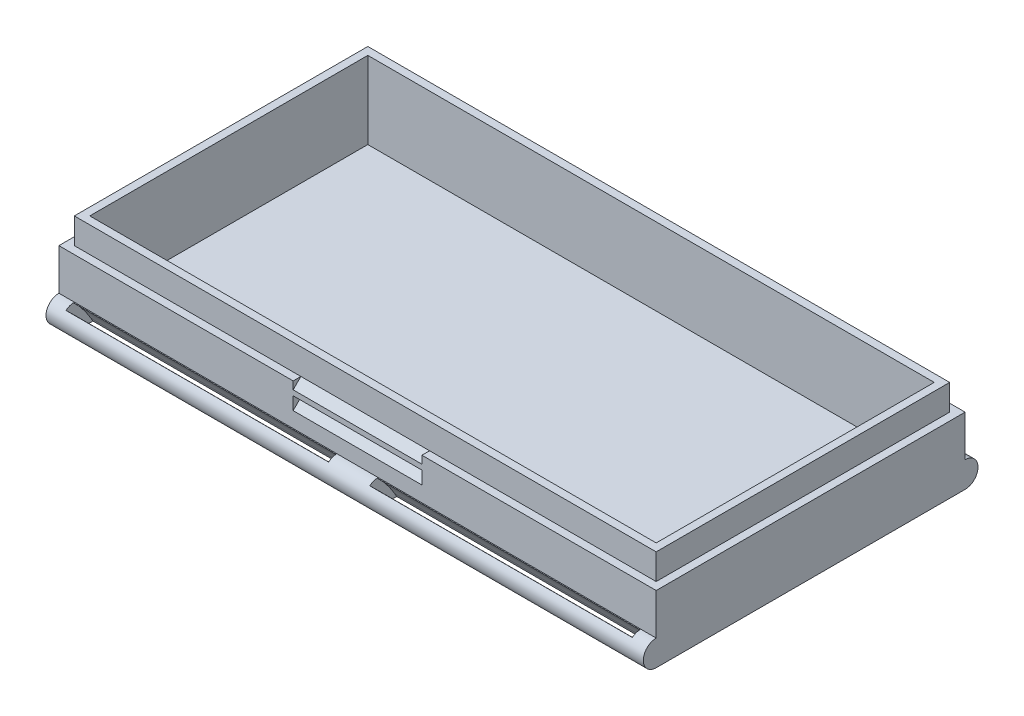
from build123d import *

# Parameters (mm, degrees)
SKETCH1_W                       = 116
SKETCH1_H                       = 60
SKETCH1_W_2                     = 110
SKETCH1_H_2                     = 54
BOSS_EXTRUDE1_DEPTH             = 10
SKETCH2_W                       = 116
SKETCH2_H                       = 60
BOSS_EXTRUDE2_DEPTH             = 3
CUT_EXTRUDE1_DEPTH              = 12.5
BOSS_EXTRUDE4_REACH             = 68.061
BOSS_EXTRUDE4_DIRECTION_2_REACH = 68.061
BOSS_EXTRUDE5_DEPTH             = 55
CUT_EXTRUDE2_DEPTH              = 4
SKETCH7_W                       = 113
SKETCH7_H                       = 57
SKETCH7_W_2                     = 110
SKETCH7_H_2                     = 54
BOSS_EXTRUDE6_DEPTH             = 5


with BuildPart() as part:
    # Sketch1 → Boss-Extrude1 (new body)
    with BuildSketch(Plane(origin=(0, 0, 0), x_dir=(1, 0, 0), z_dir=(0, 1, 0))):
        Rectangle(SKETCH1_W, SKETCH1_H)
        Rectangle(SKETCH1_W_2, SKETCH1_H_2, mode=Mode.SUBTRACT)
    extrude(amount=BOSS_EXTRUDE1_DEPTH)

    # Sketch2 → Boss-Extrude2 (add)
    with BuildSketch(Plane.XZ):
        Rectangle(SKETCH2_W, SKETCH2_H)
    extrude(amount=BOSS_EXTRUDE2_DEPTH)

    # Sketch3 → Cut-Extrude1 (cut, symmetric)
    with BuildSketch(Plane(origin=(0, 0, 0), x_dir=(0, 0, -1), z_dir=(1, 0, 0))):
        Polygon((-28.5, 10), (-31, 10), (-31, 4), (-28.5, 6.5), (-28.5, 7.5), (-30, 7.5), (-30, 8.5), align=None)
    cut_extrude1 = extrude(amount=CUT_EXTRUDE1_DEPTH, both=True, mode=Mode.SUBTRACT)

    # Mirror1: Cut-Extrude1 across plane
    add(cut_extrude1.mirror(Plane.XY), mode=Mode.SUBTRACT)

    # Boss-Extrude4: up to this face of the body (flat: up to its plane)
    boss_extrude4_end = Plane(part.part.faces().sort_by_distance((58, 3.5, 0))[0])
    # Sketch4 → Boss-Extrude4 (add, up to the picked face)
    with BuildSketch(Plane(origin=(0, 0, 0), x_dir=(0, 0, -1), z_dir=(1, 0, 0)), mode=Mode.PRIVATE) as boss_extrude4_sk1:
        with BuildLine():
            Line((30, 2), (30, -3))
            ThreePointArc((30, -3), (32.5, -0.5), (30, 2))
        make_face()
    boss_extrude4_tool1 = split(extrude(boss_extrude4_sk1.sketch, amount=BOSS_EXTRUDE4_REACH, mode=Mode.PRIVATE), bisect_by=boss_extrude4_end, keep=Keep.BOTH, mode=Mode.PRIVATE)
    boss_extrude4 = boss_extrude4_tool1.solids().sort_by(Axis((0, -0.5, -31.061033), (1, 0, 0)))[0]
    add(boss_extrude4)

    # Boss-Extrude4 direction 2: up to this face of the body (flat: up to its plane)
    boss_extrude4_direction_2_end = Plane(part.part.faces().sort_by_distance((-58, 3.5, 0))[0])
    # Sketch4 → Boss-Extrude4 direction 2 (add, up to the picked face)
    with BuildSketch(Plane(origin=(0, 0, 0), x_dir=(0, 0, -1), z_dir=(1, 0, 0)), mode=Mode.PRIVATE) as boss_extrude4_direction_2_sk1:
        with BuildLine():
            Line((30, 2), (30, -3))
            ThreePointArc((30, -3), (32.5, -0.5), (30, 2))
        make_face()
    boss_extrude4_direction_2_tool1 = split(extrude(boss_extrude4_direction_2_sk1.sketch, amount=-BOSS_EXTRUDE4_DIRECTION_2_REACH, mode=Mode.PRIVATE), bisect_by=boss_extrude4_direction_2_end, keep=Keep.BOTH, mode=Mode.PRIVATE)
    boss_extrude4_direction_2 = boss_extrude4_direction_2_tool1.solids().sort_by(Axis((0, -0.5, -31.061033), (-1, 0, 0)))[0]
    add(boss_extrude4_direction_2)

    # Mirror3: Boss-Extrude4, Boss-Extrude4 direction 2 across plane
    add(boss_extrude4.mirror(Plane.XY))
    add(boss_extrude4_direction_2.mirror(Plane.XY))


with BuildPart() as body_2:
    # Sketch5 → Boss-Extrude5 (new, symmetric)
    with BuildSketch(Plane(origin=(0, 0, 0), x_dir=(0, 0, -1), z_dir=(1, 0, 0))):
        with BuildLine():
            Line((26.787564435, -2.3), (26.383419246, -3))
            Line((26.383419246, -3), (28, -3))
            ThreePointArc((28, -3), (29.996934481, -0.214678652), (32.5, 2.126352177))
            Line((32.5, 2.126352177), (32.5, 3.852866185))
            ThreePointArc((32.5, 3.852866185), (29.29668765, 1.098682153), (26.787564435, -2.3))
        make_face()
    extrude(amount=BOSS_EXTRUDE5_DEPTH, both=True)

    # Sketch6 → Cut-Extrude2 (cut, symmetric)
    with BuildSketch(Plane(origin=(0, 0, 0), x_dir=(0, 0, -1), z_dir=(1, 0, 0))):
        with BuildLine():
            Line((26.383419246, -3), (28, -3))
            ThreePointArc((28, -3), (29.996934481, -0.214678652), (32.5, 2.126352177))
            Line((32.5, 2.126352177), (32.5, 3.852866185))
            ThreePointArc((32.5, 3.852866185), (29.29668765, 1.098682153), (26.787564435, -2.3))
            Line((26.787564435, -2.3), (26.383419246, -3))
        make_face()
    extrude(amount=CUT_EXTRUDE2_DEPTH, both=True, mode=Mode.SUBTRACT)


with BuildPart() as cut_extrude2_piece_1:
    # of the separate pieces the step leaves, piece 1, a body of its own (cut_extrude2_pieces)
    add(body_2.part.solids().sort_by_distance((-4, -2.3, -26.787564435))[0])


with BuildPart() as cut_extrude2_piece_2:
    # of the separate pieces the step leaves, piece 2, a body of its own (cut_extrude2_pieces)
    add(body_2.part.solids().sort_by_distance((55, -2.3, -26.787564435))[0])


with BuildPart() as body_4:
    # Mirror2: mirrored copy
    add(cut_extrude2_piece_1.part.mirror(Plane.XY))


with BuildPart() as body_5:
    # Mirror2 2: mirrored copy
    add(cut_extrude2_piece_2.part.mirror(Plane.XY))


with BuildPart() as part_1:
    add(part.part)

    # Combine2: cut Cut-Extrude2 piece 1, Cut-Extrude2 piece 2, body 5, body 4
    add(cut_extrude2_piece_1.part, mode=Mode.SUBTRACT)
    add(cut_extrude2_piece_2.part, mode=Mode.SUBTRACT)
    add(body_5.part, mode=Mode.SUBTRACT)
    add(body_4.part, mode=Mode.SUBTRACT)

    # Sketch7 → Boss-Extrude6 (add)
    with BuildSketch(Plane(origin=(0, 10, 0), x_dir=(1, 0, 0), z_dir=(0, 1, 0))):
        Rectangle(SKETCH7_W, SKETCH7_H)
        Rectangle(SKETCH7_W_2, SKETCH7_H_2, mode=Mode.SUBTRACT)
    extrude(amount=BOSS_EXTRUDE6_DEPTH)


solid = part_1.part
